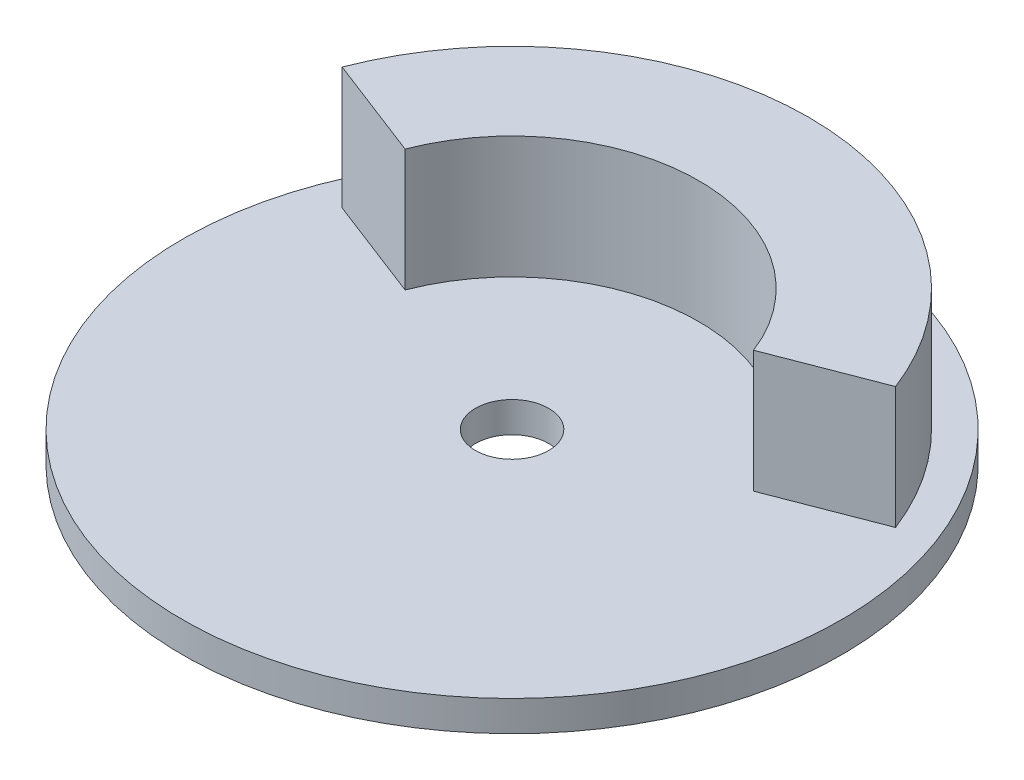
from build123d import *

# Parameters (mm, degrees)
BOSS_EXTRUDE1_DEPTH = 10
SKETCH2_R           = 27
SKETCH2_R_2         = 3
BOSS_EXTRUDE2_DEPTH = 2.5


with BuildPart() as part:
    # Sketch1 → Boss-Extrude1 (new body)
    with BuildSketch(Plane(origin=(0, 0, 0), x_dir=(1, 0, 0), z_dir=(0, 1, 0))):
        with BuildLine():
            Line((-22.669793675, 8.750454545), (-14.273573795, 5.509545455))
            ThreePointArc((-14.273573795, 5.509545455), (0, 15.3), (14.273573795, 5.509545455))
            Line((14.273573795, 5.509545455), (22.669793675, 8.750454545))
            ThreePointArc((22.669793675, 8.750454545), (0, 24.3), (-22.669793675, 8.750454545))
        make_face()
    extrude(amount=BOSS_EXTRUDE1_DEPTH)

    # Sketch2 → Boss-Extrude2 (add)
    with BuildSketch(Plane.XZ):
        with Locations(Location((0, 0, 0), (0, 0, 270))):
            Circle(SKETCH2_R)
        with Locations(Location((0, 0, 0), (0, 0, 270))):
            Circle(SKETCH2_R_2, mode=Mode.SUBTRACT)
    extrude(amount=BOSS_EXTRUDE2_DEPTH)


solid = part.part
